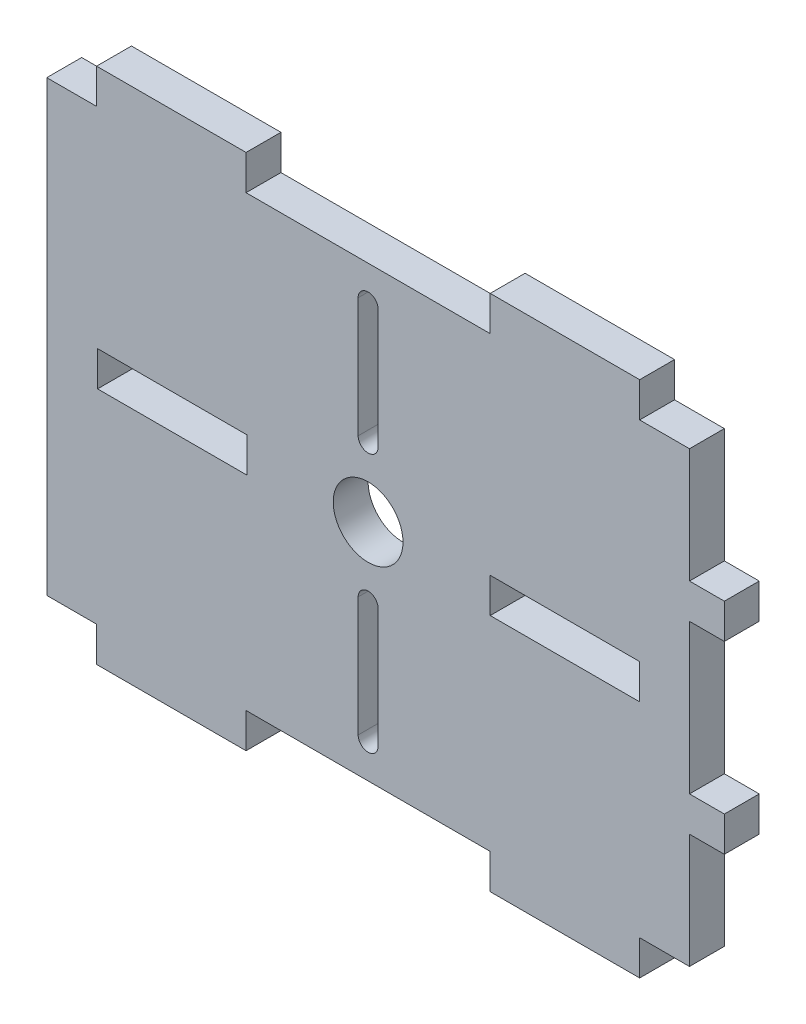
from build123d import *

# Parameters (mm, degrees)
SKETCH1_R           = 3.5
BOSS_EXTRUDE1_DEPTH = 3.5
SKETCH2_W           = 15
SKETCH2_H           = 3.5
CUT_EXTRUDE1_DEPTH  = 45.343122353


with BuildPart() as part:
    # Sketch1 → Boss-Extrude1 (new body)
    with BuildSketch(Plane.XY):
        Polygon((27.25, -26), (27.25, -22.5), (32.25, -22.5), (32.25, -11), (35.75, -11), (35.75, -7.5), (32.25, -7.5), (32.25, 7.5), (35.75, 7.5), (35.75, 11), (32.25, 11), (32.25, 22.5), (27.25, 22.5), (27.25, 26), (12.25, 26), (12.25, 22.5), (-12.25, 22.5), (-12.25, 26), (-27.25, 26), (-27.25, 22.5), (-32.25, 22.5), (-32.25, -22.5), (-27.25, -22.5), (-27.25, -26), (-12.25, -26), (-12.25, -22.5), (12.25, -22.5), (12.25, -26), align=None)
        Circle(SKETCH1_R, mode=Mode.SUBTRACT)
        with BuildLine():
            Line((1, 19), (1, 7))
            ThreePointArc((1, 7), (0, 6), (-1, 7))
            Line((-1, 7), (-1, 19))
            ThreePointArc((-1, 19), (0, 20), (1, 19))
        make_face(mode=Mode.SUBTRACT)
        with BuildLine():
            Line((1, -19), (1, -7))
            ThreePointArc((1, -7), (0, -6), (-1, -7))
            Line((-1, -7), (-1, -19))
            ThreePointArc((-1, -19), (0, -20), (1, -19))
        make_face(mode=Mode.SUBTRACT)
    extrude(amount=BOSS_EXTRUDE1_DEPTH)

    # Sketch2 → Cut-Extrude1 (cut, through all)
    with BuildSketch(Plane(origin=(0, 0, 0), x_dir=(-1, 0, 0), z_dir=(0, 0, -1))):
        with Locations((19.65, -0.25)):
            Rectangle(SKETCH2_W, SKETCH2_H)
        with Locations((-19.75, -0.25)):
            Rectangle(SKETCH2_W, SKETCH2_H)
    extrude(amount=-CUT_EXTRUDE1_DEPTH, mode=Mode.SUBTRACT)


solid = part.part
